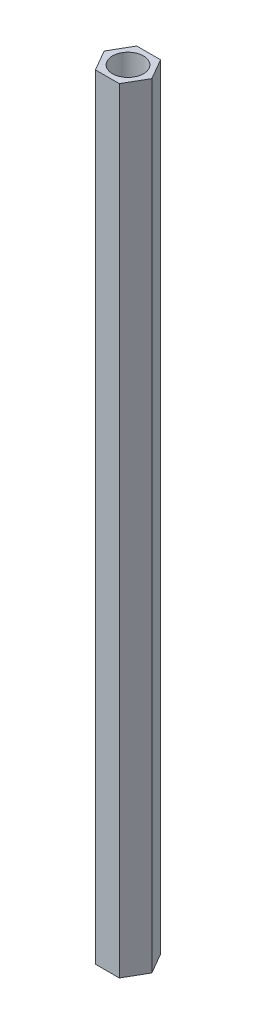
from build123d import *

# Parameters (mm, degrees)
EXTRUDE_1_DEPTH     = 75
SKETCH_2_R          = 1.5
CUT_EXTRUDE_1_DEPTH = 76.062196433


with BuildPart() as part:
    # 草图1 → 凸台-拉伸1 (new body)
    with BuildSketch(Plane(origin=(0, 0, 0), x_dir=(1, 0, 0), z_dir=(0, 1, 0))):
        Polygon((2.309401077, 0), (1.154700538, 2), (-1.154700538, 2), (-2.309401077, 0), (-1.154700538, -2), (1.154700538, -2), align=None)
    extrude(amount=EXTRUDE_1_DEPTH)

    # 草图2 → 切除-拉伸1 (cut, through all)
    with BuildSketch(Plane(origin=(0, 75, 0), x_dir=(1, 0, 0), z_dir=(0, 1, 0))):
        with Locations(Location((0, 0, 0), (0, 0, 270))):
            Circle(SKETCH_2_R)
    extrude(amount=-CUT_EXTRUDE_1_DEPTH, mode=Mode.SUBTRACT)


solid = part.part
